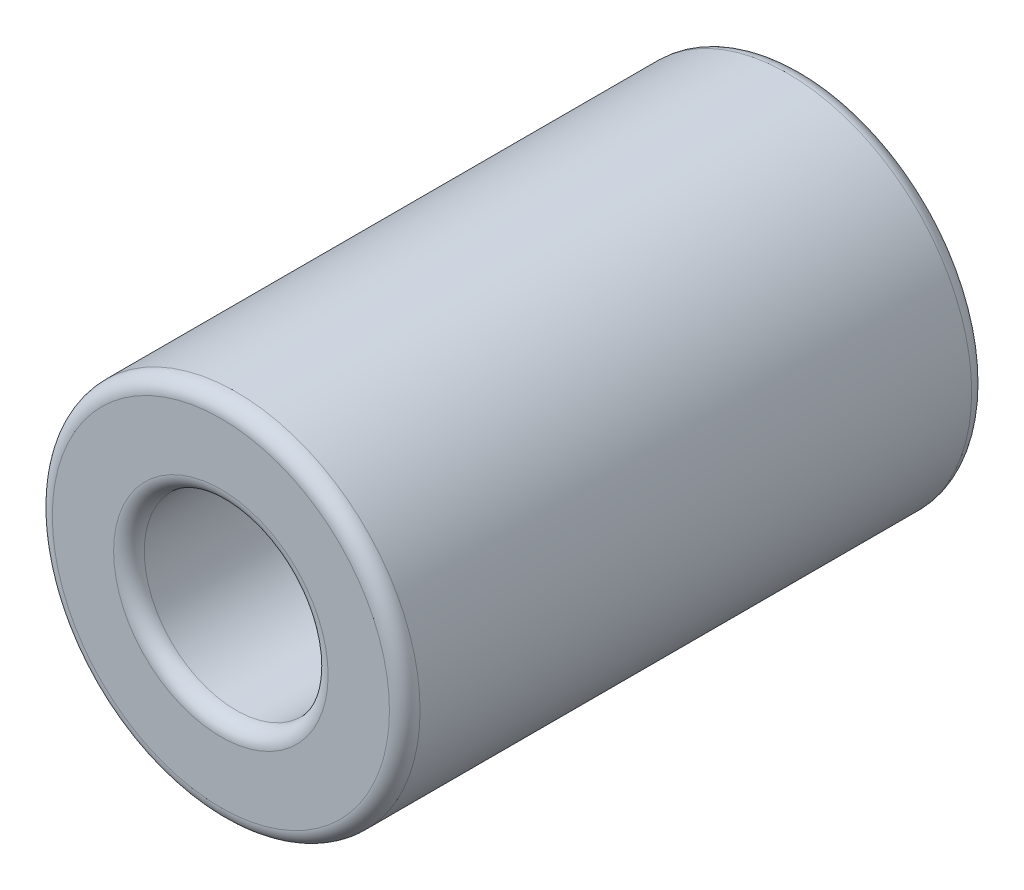
from build123d import *

# Parameters (mm, degrees)
SKETCH_1_R      = 6
SKETCH_1_R_2    = 3
EXTRUDE_1_DEPTH = 19
FILLET_1_R      = 0.5


with BuildPart() as part:
    # 草图1 → 凸台-拉伸1 (new body)
    with BuildSketch(Plane.XY):
        Circle(SKETCH_1_R)
        Circle(SKETCH_1_R_2, mode=Mode.SUBTRACT)
    extrude(amount=EXTRUDE_1_DEPTH)

    # 圆角1
    fillet_1_edges = [part.edges().sort_by_distance(p)[0] for p in [
        (-6, 0, 0),
        (-6, 0, 19),
        (-3, 0, 0),
        (-3, 0, 19),
    ]]
    fillet(fillet_1_edges, radius=FILLET_1_R)


solid = part.part
